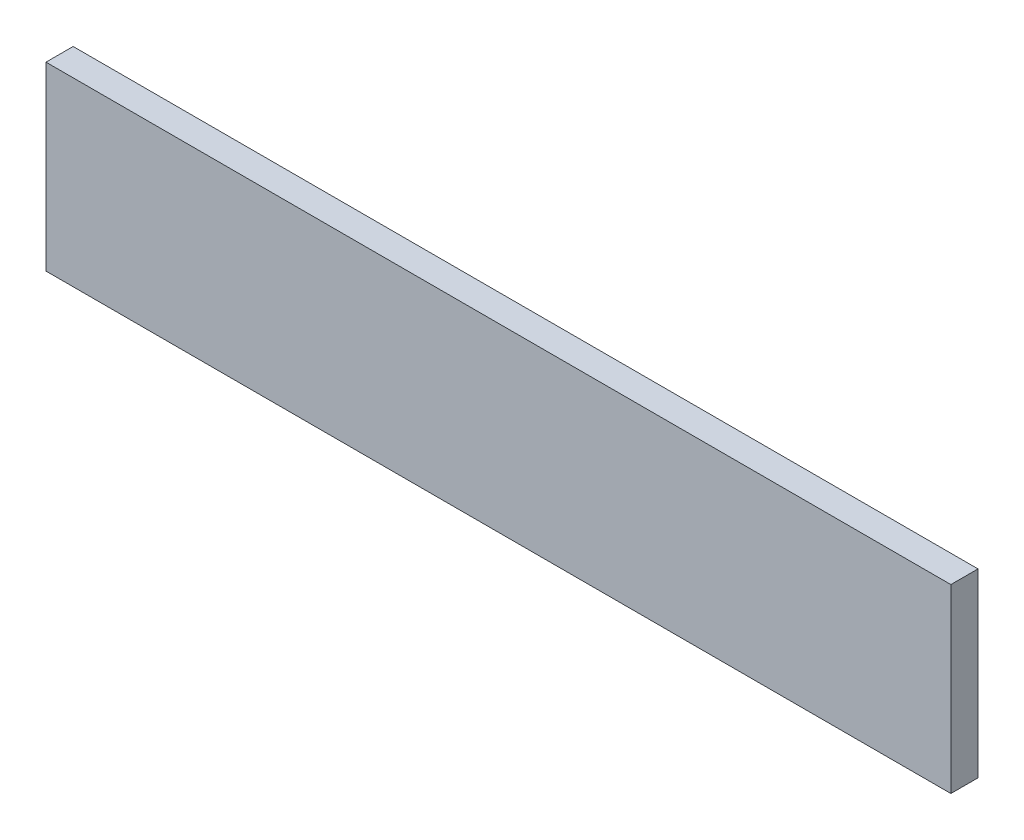
from build123d import *

# Parameters (mm, degrees)
CROQUIS1_W              = 200
CROQUIS1_H              = 40
SALIENTE_EXTRUIR1_DEPTH = 6


with BuildPart() as part:
    # Croquis1 → Saliente-Extruir1 (new body)
    with BuildSketch(Plane.XY):
        Rectangle(CROQUIS1_W, CROQUIS1_H)
    extrude(amount=SALIENTE_EXTRUIR1_DEPTH)


solid = part.part
